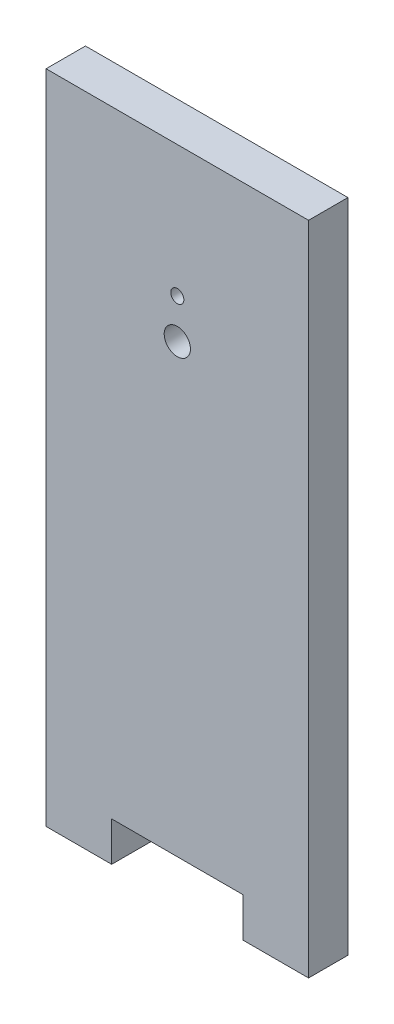
from build123d import *

# Parameters (mm, degrees)
SKETCH1_R           = 0.5
SKETCH1_R_2         = 1
BOSS_EXTRUDE1_DEPTH = 3


with BuildPart() as part:
    # Sketch1 → Boss-Extrude1 (new body)
    with BuildSketch(Plane.XY):
        Polygon((-5, -22), (5, -22), (5, -25), (10, -25), (10, 25), (-10, 25), (-10, -25), (-5, -25), align=None)
        with Locations((0, 15)):
            Circle(SKETCH1_R, mode=Mode.SUBTRACT)
        with Locations((0, 12)):
            Circle(SKETCH1_R_2, mode=Mode.SUBTRACT)
    extrude(amount=BOSS_EXTRUDE1_DEPTH)


solid = part.part
